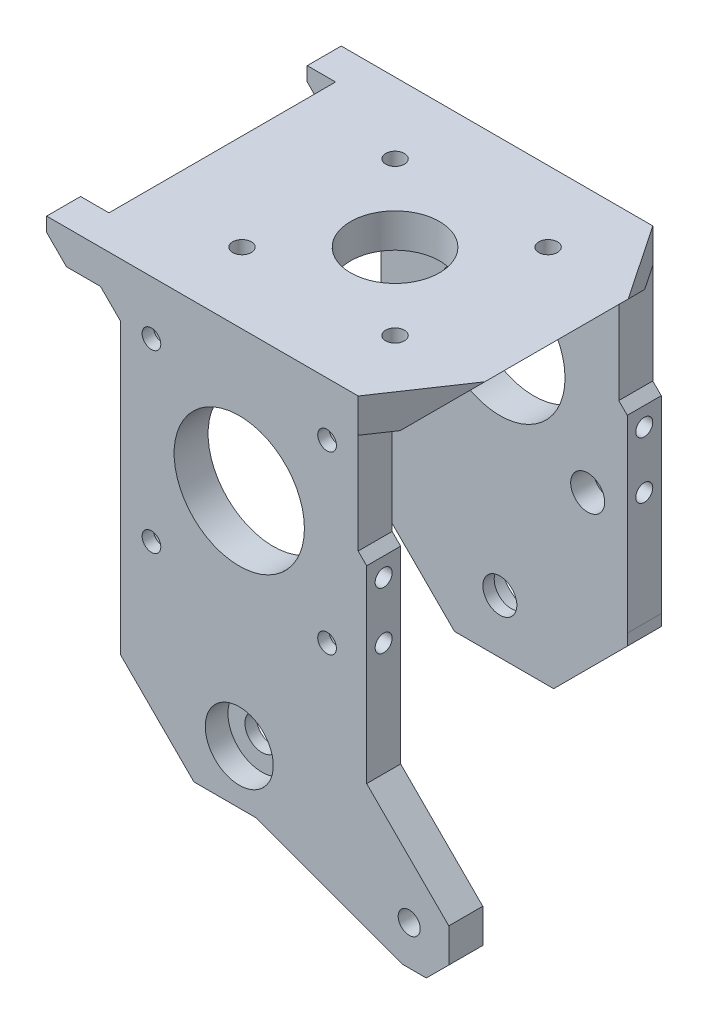
from build123d import *

# Parameters (mm, degrees)
BOSS_EXTRUDE1_DEPTH = 52
BOSS_EXTRUDE3_START = 52
BOSS_EXTRUDE3_DEPTH = 6
CUT_EXTRUDE5_DEPTH  = 76
SKETCH9_W           = 5
SKETCH9_H           = 28
SKETCH9_R           = 7.85
SKETCH9_R_2         = 1.65
CUT_EXTRUDE6_DEPTH  = 21
SKETCH14_R          = 11.5
SKETCH14_R_2        = 1.65
SKETCH14_R_3        = 3
SKETCH14_R_4        = 1.95
CUT_EXTRUDE7_DEPTH  = 62
SKETCH25_R          = 3
CUT_EXTRUDE8_DEPTH  = 3.5
SKETCH26_R          = 6
CUT_EXTRUDE9_DEPTH  = 4
CUT_EXTRUDE10_START = -4
SKETCH27_R          = 6
CUT_EXTRUDE10_DEPTH = 4
SKETCH34_R          = 3
CUT_EXTRUDE11_DEPTH = 4
CUT_EXTRUDE12_START = -4
SKETCH35_R          = 3
CUT_EXTRUDE12_DEPTH = 4
SKETCH36_R          = 4
CUT_EXTRUDE13_DEPTH = 3
SKETCH37_R          = 1.5
CUT_EXTRUDE14_DEPTH = 5
SKETCH38_R          = 1.6
CUT_EXTRUDE15_DEPTH = 4
CUT_EXTRUDE16_START = -6
CUT_EXTRUDE16_DEPTH = 40


with BuildPart() as part:
    # Sketch1 → Boss-Extrude1 (new body)
    with BuildSketch(Plane.XY):
        Polygon((31.992612588, 32.452997252), (38.003020228, 38.463404892), (-25.996979772, 38.463404892), (-25.996979772, 35.963404892), (-22.496801205, 32.463226325), (-16.496801205, 32.463226325), (-12.996622638, 28.963047758), (-12.996622638, -22.036952242), (0, -35.03357488), (10.9, -35.03357488), (17.5, -35.03357488), (30.510764774, -22.022810106), (30.491678964, -20.046069124), (30.491678964, 13.253930876), (28.992612588, 14.752997252), (28.992612588, 32.452997252), align=None)
    extrude(amount=BOSS_EXTRUDE1_DEPTH)

    # Sketch1<4> → Boss-Extrude3 (add)
    with BuildSketch(Plane.XY.offset(BOSS_EXTRUDE3_START)):
        Polygon((44.987367978, -34.541758139), (30.491678964, -20.046069124), (30.510764774, -22.022810106), (17.5, -35.03357488), (10.9, -35.03357488), (36.910691743, -44.500692447), (41.010691743, -44.500692447), (44.987367978, -40.541758139), align=None)
    extrude(amount=-BOSS_EXTRUDE3_DEPTH)

    # Sketch8 → Cut-Extrude5 (cut)
    with BuildSketch(Plane(origin=(40.491678964, 0, 0), x_dir=(0, 0, -1), z_dir=(1, 0, 0))):
        Polygon((-46, -49.839210224), (-6, -35.03357488), (-6, 32.452997252), (-46, 32.452997252), align=None)
    extrude(amount=-CUT_EXTRUDE5_DEPTH, mode=Mode.SUBTRACT)

    # Sketch9 → Cut-Extrude6 (cut)
    with BuildSketch(Plane(origin=(0, 38.463404892, 0), x_dir=(1, 0, 0), z_dir=(0, 1, 0))):
        with Locations((-23.496979772, -26)):
            Rectangle(SKETCH9_W, SKETCH9_H)
        Polygon((37.951108861, -38.736074871), (29.003020228, -52), (38.003020228, -52), (38.003020228, -38.759111283), align=None)
        Polygon((38.003020228, 0), (29.003020228, 0), (37.951108861, -13.263925129), (38.003020228, -13.220806137), align=None)
        with Locations((9.503020228, -26)):
            Circle(SKETCH9_R)
        with Locations((-4.002719293, -12.494260479)):
            Circle(SKETCH9_R_2)
        with Locations((23.008759749, -12.494260479)):
            Circle(SKETCH9_R_2)
        with Locations((23.008759749, -39.505739521)):
            Circle(SKETCH9_R_2)
        with Locations((-4.002719293, -39.505739521)):
            Circle(SKETCH9_R_2)
    extrude(amount=-CUT_EXTRUDE6_DEPTH, mode=Mode.SUBTRACT)

    # Sketch14 → Cut-Extrude7 (cut)
    with BuildSketch(Plane.XY.offset(52)):
        with Locations((8.003377362, 13.463404892)):
            Circle(SKETCH14_R)
        with Locations((-7.496403282, -2.036375752)):
            Circle(SKETCH14_R_2)
        with Locations((-7.496403282, 28.963185535)):
            Circle(SKETCH14_R_2)
        with Locations((23.503158005, 28.963185535)):
            Circle(SKETCH14_R_2)
        with Locations((23.503158005, -2.036375752)):
            Circle(SKETCH14_R_2)
        with Locations((8.003377362, -25.536595108)):
            Circle(SKETCH14_R_3)
        with Locations((38.002754428, -37.535489875)):
            Circle(SKETCH14_R_4)
    extrude(amount=-CUT_EXTRUDE7_DEPTH, mode=Mode.SUBTRACT)

    # Sketch25 → Cut-Extrude8 (cut)
    with BuildSketch(Plane.XZ.offset(-32.452997252)):
        with Locations((-4.002719293, 39.505739521)):
            Circle(SKETCH25_R)
        with Locations((23.008759749, 39.505739521)):
            Circle(SKETCH25_R)
        with Locations((23.008759749, 12.494260479)):
            Circle(SKETCH25_R)
        with Locations((-4.002719293, 12.494260479)):
            Circle(SKETCH25_R)
    extrude(amount=-CUT_EXTRUDE8_DEPTH, mode=Mode.SUBTRACT)

    # Sketch26 → Cut-Extrude9 (cut)
    with BuildSketch(Plane(origin=(0, 0, 0), x_dir=(-1, 0, 0), z_dir=(0, 0, -1))):
        with Locations((-8.003377362, -25.536595108)):
            Circle(SKETCH26_R)
    extrude(amount=-CUT_EXTRUDE9_DEPTH, mode=Mode.SUBTRACT)

    # Sketch27 → Cut-Extrude10 (cut)
    with BuildSketch(Plane.XY.offset(52).offset(CUT_EXTRUDE10_START)):
        with Locations((8.003377362, -25.536595108)):
            Circle(SKETCH27_R)
    extrude(amount=CUT_EXTRUDE10_DEPTH, mode=Mode.SUBTRACT)

    # Sketch34 → Cut-Extrude11 (cut)
    with BuildSketch(Plane(origin=(0, 0, 46), x_dir=(-1, 0, 0), z_dir=(0, 0, -1))):
        with Locations((-23.503158005, 28.963185535)):
            Circle(SKETCH34_R)
        with Locations((7.496403282, 28.963185535)):
            Circle(SKETCH34_R)
        with Locations((7.496403282, -2.036375752)):
            Circle(SKETCH34_R)
        with Locations((-23.503158005, -2.036375752)):
            Circle(SKETCH34_R)
    extrude(amount=-CUT_EXTRUDE11_DEPTH, mode=Mode.SUBTRACT)

    # Sketch35 → Cut-Extrude12 (cut)
    with BuildSketch(Plane.XY.offset(6).offset(CUT_EXTRUDE12_START)):
        with Locations((-7.496403282, 28.963185535)):
            Circle(SKETCH35_R)
        with Locations((23.503158005, -2.036375752)):
            Circle(SKETCH35_R)
        with Locations((-7.496403282, -2.036375752)):
            Circle(SKETCH35_R)
        with Locations((23.503158005, 28.963185535)):
            Circle(SKETCH35_R)
    extrude(amount=CUT_EXTRUDE12_DEPTH, mode=Mode.SUBTRACT)

    # Sketch36 → Cut-Extrude13 (cut)
    with BuildSketch(Plane(origin=(0, 0, 46), x_dir=(-1, 0, 0), z_dir=(0, 0, -1))):
        with Locations((-38.002754428, -37.535489875)):
            Circle(SKETCH36_R)
    extrude(amount=-CUT_EXTRUDE13_DEPTH, mode=Mode.SUBTRACT)

    # Sketch37 → Cut-Extrude14 (cut)
    with BuildSketch(Plane(origin=(30.491678964, 0, 0), x_dir=(0, 0, -1), z_dir=(1, 0, 0))):
        with Locations((-3, 9.953930876)):
            Circle(SKETCH37_R)
        with Locations((-3, -0.046069124)):
            Circle(SKETCH37_R)
        with Locations((-49, 9.953930876)):
            Circle(SKETCH37_R)
        with Locations((-49, -0.046069124)):
            Circle(SKETCH37_R)
    extrude(amount=-CUT_EXTRUDE14_DEPTH, mode=Mode.SUBTRACT)

    # Sketch38 → Cut-Extrude15 (cut)
    with BuildSketch(Plane.ZY.offset(12.996622638)):
        with Locations((49, 13.963047758)):
            Circle(SKETCH38_R)
        with Locations((49, 3.963047758)):
            Circle(SKETCH38_R)
        with Locations((3, 13.963047758)):
            Circle(SKETCH38_R)
        with Locations((3, 3.963047758)):
            Circle(SKETCH38_R)
    extrude(amount=-CUT_EXTRUDE15_DEPTH, mode=Mode.SUBTRACT)

    # Sketch39 → Cut-Extrude16 (cut)
    with BuildSketch(Plane.XY.offset(12).offset(CUT_EXTRUDE16_START)):
        Polygon((-22.496979772, 38.463404892), (-25.996979772, 38.463404892), (-28.276459711, 32.970357014), (-19.102709926, 28.692570726), (-16.496801205, 32.463226325), (-20.996979772, 38.463404892), align=None)
    extrude(amount=CUT_EXTRUDE16_DEPTH, mode=Mode.SUBTRACT)


solid = part.part
